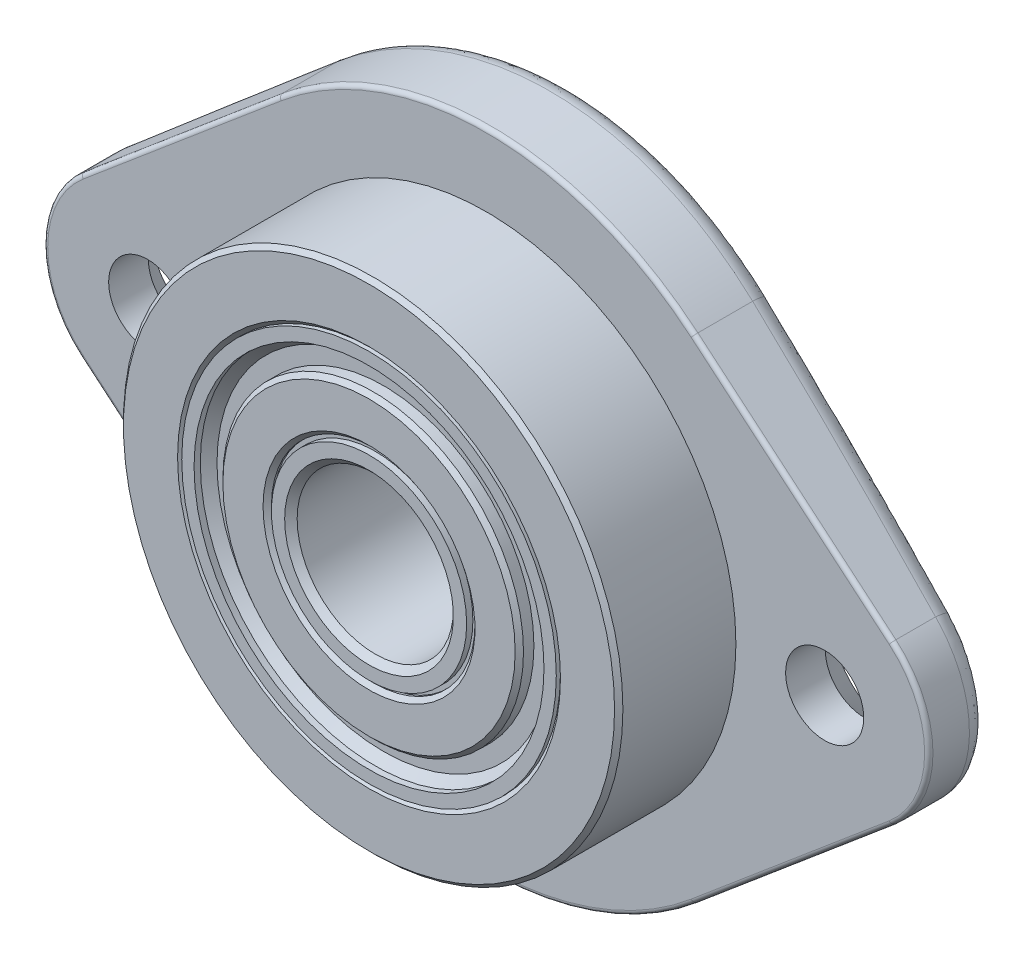
from build123d import *

# Parameters (mm, degrees)
CHAMFER2_SIZE           = 0.381
CHAMFER3_SIZE           = 0.254
CHAMFER4_SIZE           = 0.508
EXTRUDE1_START          = -6.151562
SKETCH2_R               = 2.38125
EXTRUDE1_DEPTH          = 5.159375
SKETCH9_R               = 15.225117187
SKETCH9_R_2             = 11.418837891
BOSS_EXTRUDE2_DEPTH     = 7.14375
CHAMFER5_SIZE           = 0.254
CUT_EXTRUDE1_DEPTH      = 34.942674919
CUT_EXTRUDE1_DEPTH_BACK = 34.942674919
FILLET2_R               = 1.27
FILLET3_R               = 0.254


with BuildPart() as part:
    # Sketch3 → Revolve1 (revolve)
    with BuildSketch(Plane(origin=(0, 0, 0), x_dir=(0, 0, -1), z_dir=(1, 0, 0)), mode=Mode.PRIVATE) as revolve1_sk:
        Polygon((-6.1515625, 5.953125), (-5.7705625, 5.953125), (-5.7705625, 6.207125), (-6.1515625, 6.207125), (-6.1515625, 9.165497396), (-5.2625625, 9.165497396), (-5.2625625, 10.667724392), (-6.1515625, 10.667724392), (-6.1515625, 11.418837891), (0.9921875, 11.418837891), (0.9921875, 4.7625), (-6.1515625, 4.7625), align=None)
    revolve(revolve1_sk.sketch.rotate(Axis((0, 0, 6.1515625), (0, 0, -1)), 90), axis=Axis((0, 0, 6.1515625), (0, 0, -1)))

    # Chamfer2
    chamfer2_edges = [part.edges().sort_by_distance(p)[0] for p in [
        (-4.7625, 0, 6.1515625),
    ]]
    chamfer(chamfer2_edges, length=CHAMFER2_SIZE)

    # Chamfer3
    chamfer3_edges = [part.edges().sort_by_distance(p)[0] for p in [
        (-6.207125, 0, 6.1515625),
        (-9.165497396, 0, 6.1515625),
    ]]
    chamfer(chamfer3_edges, length=CHAMFER3_SIZE)

    # Chamfer4
    chamfer4_edges = [part.edges().sort_by_distance(p)[0] for p in [
        (-10.667724392, 0, 5.2625625),
    ]]
    chamfer(chamfer4_edges, length=CHAMFER4_SIZE)


with BuildPart() as body_2:
    # Sketch2 → Extrude1 (new body)
    with BuildSketch(Plane.XY.offset(EXTRUDE1_START)):
        with BuildLine():
            Line((24.728365385, 4.856677919), (12.656114784, 15.025347311))
            ThreePointArc((12.656114784, 15.025347311), (0, 19.6453125), (-12.656114784, 15.025347311))
            Line((-12.656114784, 15.025347311), (-24.728365385, 4.856677919))
            ThreePointArc((-24.728365385, 4.856677919), (-26.9875, 0), (-24.728365385, -4.856677919))
            Line((-24.728365385, -4.856677919), (-12.656114784, -15.025347311))
            ThreePointArc((-12.656114784, -15.025347311), (0, -19.6453125), (12.656114784, -15.025347311))
            Line((12.656114784, -15.025347311), (24.728365385, -4.856677919))
            ThreePointArc((24.728365385, -4.856677919), (26.9875, 0), (24.728365385, 4.856677919))
        make_face()
        with Locations((20.6375, 0)):
            Circle(SKETCH2_R, mode=Mode.SUBTRACT)
        with Locations((-20.6375, 0)):
            Circle(SKETCH2_R, mode=Mode.SUBTRACT)
    extrude(amount=EXTRUDE1_DEPTH)

    # Sketch9 → Boss-Extrude2 (add)
    with BuildSketch(Plane.XY.offset(-0.9921875)):
        Circle(SKETCH9_R)
        Circle(SKETCH9_R_2, mode=Mode.SUBTRACT)
    extrude(amount=BOSS_EXTRUDE2_DEPTH)

    # Chamfer5
    chamfer5_edges = [body_2.edges().sort_by_distance(p)[0] for p in [
        (-15.225117187, 0, 6.1515625),
        (-11.418837891, 0, 6.1515625),
    ]]
    chamfer(chamfer5_edges, length=CHAMFER5_SIZE)

    # Cut-Extrude2 cone 1 section (through the dimple's axis) → Cut-Extrude2 (revolve, cut)
    with BuildSketch(Plane(origin=(20.6375, 0, -6.1515625), x_dir=(0, 1, 0), z_dir=(1, 0, 0))):
        Polygon((0, 0), (4.7625, 0), (0, 5.478629539), align=None)
    revolve(axis=Axis((20.6375, 0, -6.1515625), (0, 0, 1)), mode=Mode.SUBTRACT)

    # Cut-Extrude2 cone 2 section (through the dimple's axis) → Cut-Extrude2 cone 2 (revolve, cut)
    with BuildSketch(Plane(origin=(-20.6375, 0, -6.1515625), x_dir=(0, 1, 0), z_dir=(1, 0, 0))):
        Polygon((0, 0), (4.7625, 0), (0, 5.478629539), align=None)
    revolve(axis=Axis((-20.6375, 0, -6.1515625), (0, 0, 1)), mode=Mode.SUBTRACT)

    # Sketch5 → Cut-Extrude1 (cut, two sides: drawn at the far end of the back side and taken through both)
    with BuildSketch(Plane(origin=(0, 0, 0), x_dir=(1, 0, 0), z_dir=(0, 1, 0)).offset(-CUT_EXTRUDE1_DEPTH_BACK)):
        with BuildLine():
            Line((-26.9875, 4.60375), (-26.9875, 6.6595625))
            Line((-26.9875, 6.6595625), (26.9875, 6.6595625))
            Line((26.9875, 6.6595625), (26.9875, 4.60375))
            ThreePointArc((26.9875, 4.60375), (0, 6.1515625), (-26.9875, 4.60375))
        make_face()
    extrude(amount=CUT_EXTRUDE1_DEPTH + CUT_EXTRUDE1_DEPTH_BACK, mode=Mode.SUBTRACT)

    # Fillet2
    fillet2_edges = [body_2.edges().sort_by_distance(p)[0] for p in [
        (6.745341438, 18.450980245, -6.055165518),
        (-6.745341438, -18.450980245, -6.055165518),
        (18.69584905, -9.937972719, -5.410013383),
        (26.394028321, 2.68046298, -4.671288021),
        (18.69584905, 9.937972719, -5.410013383),
        (-18.69584905, 9.937972719, -5.410013383),
        (-26.9875, 0, -4.60375),
        (-18.69584905, -9.937972719, -5.410013383),
    ]]
    fillet(fillet2_edges, radius=FILLET2_R)

    # Fillet3
    fillet3_edges = [body_2.edges().sort_by_distance(p)[0] for p in [
        (0, 19.6453125, -0.992187),
        (-18.692240084, 9.941012615, -0.992187),
        (-26.9875, 0, -0.992187),
        (-18.692240084, -9.941012615, -0.992187),
        (0, -19.6453125, -0.992187),
        (18.692240084, -9.941012615, -0.992187),
        (26.9875, 0, -0.992187),
        (18.692240084, 9.941012615, -0.992187),
    ]]
    fillet(fillet3_edges, radius=FILLET3_R)


solid = Compound([part.part, body_2.part])
